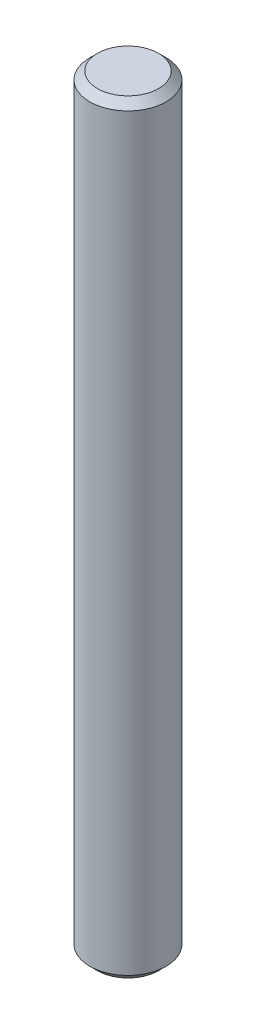
from build123d import *

# Parameters (mm, degrees)
SKETCH1_R           = 1
BOSS_EXTRUDE1_DEPTH = 20
CHAMFER1_SIZE       = 0.2


with BuildPart() as part:
    # Sketch1 → Boss-Extrude1 (new body)
    with BuildSketch(Plane(origin=(0, 0, 0), x_dir=(1, 0, 0), z_dir=(0, 1, 0))):
        with Locations(Location((0, 0, 0), (0, 0, 270))):
            Circle(SKETCH1_R)
    extrude(amount=BOSS_EXTRUDE1_DEPTH)

    # Chamfer1
    chamfer1_edges = [part.edges().sort_by_distance(p)[0] for p in [
        (0, 0, -1),
        (0, 20, -1),
    ]]
    chamfer(chamfer1_edges, length=CHAMFER1_SIZE)


solid = part.part
